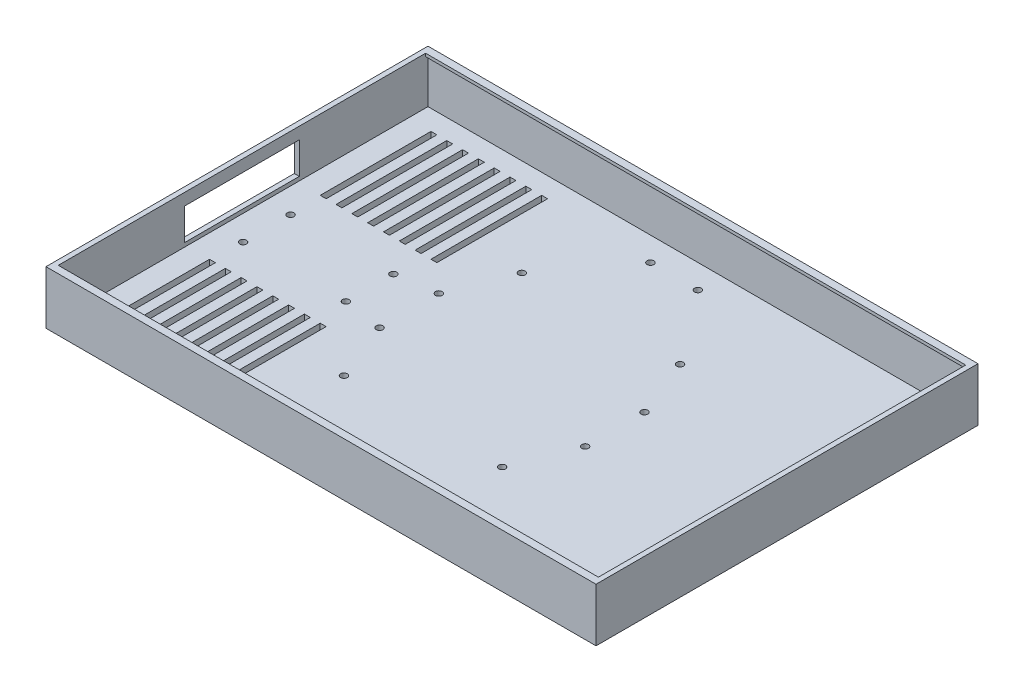
from build123d import *

# Parameters (mm, degrees)
SKETCH1_W                     = 278.2
SKETCH1_H                     = 193.2
SHELL_BLOCK_DEPTH             = 27
SKETCH2_W                     = 273.2
SKETCH2_H                     = 185.8
FRONT_OPENING_DEPTH           = 1.5
SKETCH3_W                     = 273.2
SKETCH3_H                     = 188.2
DISPLAY_POCKET_DEPTH          = 22.5
SKETCH4_W                     = 3
SKETCH4_H                     = 56
VENT_SLOTS_DEPTH              = 4
SKETCH5_W                     = 58
SKETCH5_H                     = 16
CABLE_EXIT_X_SHORT_SIDE_DEPTH = 140.1
SKETCH6_R                     = 1.7
BOLT_HOLES_DEPTH              = 4


with BuildPart() as part:
    # Sketch1 → Shell Block (new body)
    with BuildSketch(Plane(origin=(0, 0, 0), x_dir=(1, 0, 0), z_dir=(0, 1, 0))):
        Rectangle(SKETCH1_W, SKETCH1_H)
    extrude(amount=SHELL_BLOCK_DEPTH)

    # Sketch2 → Front Opening (cut)
    with BuildSketch(Plane(origin=(0, 27, 0), x_dir=(1, 0, 0), z_dir=(0, 1, 0))):
        Rectangle(SKETCH2_W, SKETCH2_H)
    extrude(amount=-FRONT_OPENING_DEPTH, mode=Mode.SUBTRACT)

    # Sketch3 → Display Pocket (cut)
    with BuildSketch(Plane(origin=(0, 25.5, 0), x_dir=(1, 0, 0), z_dir=(0, 1, 0))):
        Rectangle(SKETCH3_W, SKETCH3_H)
    extrude(amount=-DISPLAY_POCKET_DEPTH, mode=Mode.SUBTRACT)

    # Sketch4 → Vent Slots (cut)
    with BuildSketch(Plane(origin=(0, 3, 0), x_dir=(1, 0, 0), z_dir=(0, 1, 0))):
        with Locations((-67.5, 56)):
            Rectangle(SKETCH4_W, SKETCH4_H)
        with Locations((-67.5, -56)):
            Rectangle(SKETCH4_W, SKETCH4_H)
        with Locations((-75.5, 56)):
            Rectangle(SKETCH4_W, SKETCH4_H)
        with Locations((-75.5, -56)):
            Rectangle(SKETCH4_W, SKETCH4_H)
        with Locations((-83.5, 56)):
            Rectangle(SKETCH4_W, SKETCH4_H)
        with Locations((-83.5, -56)):
            Rectangle(SKETCH4_W, SKETCH4_H)
        with Locations((-91.5, 56)):
            Rectangle(SKETCH4_W, SKETCH4_H)
        with Locations((-91.5, -56)):
            Rectangle(SKETCH4_W, SKETCH4_H)
        with Locations((-99.5, 56)):
            Rectangle(SKETCH4_W, SKETCH4_H)
        with Locations((-99.5, -56)):
            Rectangle(SKETCH4_W, SKETCH4_H)
        with Locations((-107.5, 56)):
            Rectangle(SKETCH4_W, SKETCH4_H)
        with Locations((-107.5, -56)):
            Rectangle(SKETCH4_W, SKETCH4_H)
        with Locations((-115.5, 56)):
            Rectangle(SKETCH4_W, SKETCH4_H)
        with Locations((-115.5, -56)):
            Rectangle(SKETCH4_W, SKETCH4_H)
        with Locations((-123.5, 56)):
            Rectangle(SKETCH4_W, SKETCH4_H)
        with Locations((-123.5, -56)):
            Rectangle(SKETCH4_W, SKETCH4_H)
    extrude(amount=-VENT_SLOTS_DEPTH, mode=Mode.SUBTRACT)

    # Sketch5 → Cable Exit (-X short side) (cut)
    with BuildSketch(Plane(origin=(0, 0, 0), x_dir=(0, 0, -1), z_dir=(1, 0, 0))):
        with Locations((0, 13)):
            Rectangle(SKETCH5_W, SKETCH5_H)
    extrude(amount=-CABLE_EXIT_X_SHORT_SIDE_DEPTH, mode=Mode.SUBTRACT)

    # Sketch6 → Bolt Holes (cut)
    with BuildSketch(Plane(origin=(0, 3, 0), x_dir=(1, 0, 0), z_dir=(0, 1, 0))):
        with Locations(Location((-40, -45, 0), (0, 0, 270))):
            Circle(SKETCH6_R)
        with Locations(Location((-40, 45, 0), (0, 0, 270))):
            Circle(SKETCH6_R)
        with Locations(Location((40, -45, 0), (0, 0, 270))):
            Circle(SKETCH6_R)
        with Locations(Location((40, 45, 0), (0, 0, 270))):
            Circle(SKETCH6_R)
        with Locations(Location((-52, -15, 0), (0, 0, 270))):
            Circle(SKETCH6_R)
        with Locations(Location((-52, 15, 0), (0, 0, 270))):
            Circle(SKETCH6_R)
        with Locations(Location((52, -15, 0), (0, 0, 270))):
            Circle(SKETCH6_R)
        with Locations(Location((52, 15, 0), (0, 0, 270))):
            Circle(SKETCH6_R)
        with Locations(Location((-12, -82, 0), (0, 0, 270))):
            Circle(SKETCH6_R)
        with Locations(Location((-12, 82, 0), (0, 0, 270))):
            Circle(SKETCH6_R)
        with Locations(Location((12, -82, 0), (0, 0, 270))):
            Circle(SKETCH6_R)
        with Locations(Location((12, 82, 0), (0, 0, 270))):
            Circle(SKETCH6_R)
        with Locations(Location((-124, -12, 0), (0, 0, 270))):
            Circle(SKETCH6_R)
        with Locations(Location((-124, 12, 0), (0, 0, 270))):
            Circle(SKETCH6_R)
        with Locations(Location((124, -12, 0), (0, 0, 270))):
            Circle(SKETCH6_R)
        with Locations(Location((124, 12, 0), (0, 0, 270))):
            Circle(SKETCH6_R)
        with Locations(Location((-72, 12, 0), (0, 0, 270))):
            Circle(SKETCH6_R)
        with Locations(Location((-72, -12, 0), (0, 0, 270))):
            Circle(SKETCH6_R)
    extrude(amount=-BOLT_HOLES_DEPTH, mode=Mode.SUBTRACT)


solid = part.part
